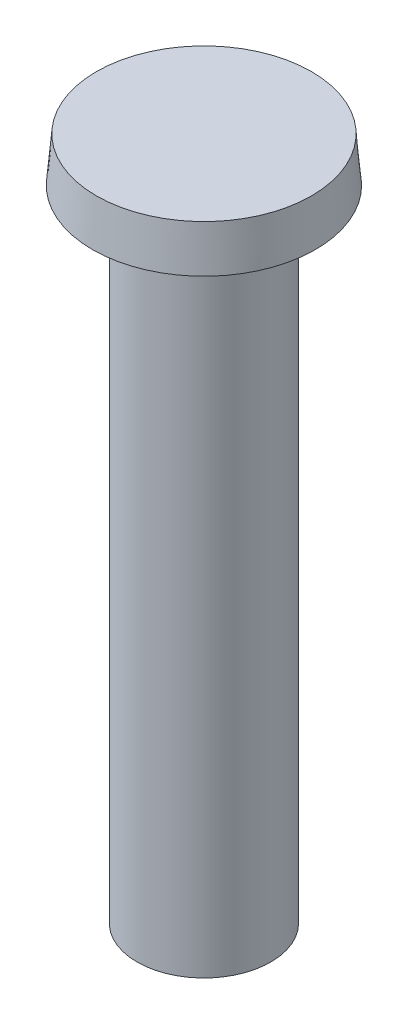
from build123d import *

# Parameters (mm, degrees)
SKETCH1_R           = 2.25
BOSS_EXTRUDE1_DEPTH = 21.5
SKETCH2_R           = 3.75
BOSS_EXTRUDE2_DEPTH = 1.5
BOSS_EXTRUDE2_TAPER = 5
SKETCH3_R           = 1
CUT_EXTRUDE1_DEPTH  = 6
CUT_EXTRUDE1_DRAFT  = -1


with BuildPart() as part:
    # Sketch1 → Boss-Extrude1 (new body)
    with BuildSketch(Plane(origin=(0, 0, 0), x_dir=(1, 0, 0), z_dir=(0, 1, 0))):
        with Locations(Location((0, 0, 0), (0, 0, 270))):
            Circle(SKETCH1_R)
    extrude(amount=BOSS_EXTRUDE1_DEPTH)

    # Sketch2 → Boss-Extrude2 (add)
    with BuildSketch(Plane(origin=(0, 21.5, 0), x_dir=(1, 0, 0), z_dir=(0, 1, 0))):
        Circle(SKETCH2_R)
    extrude(amount=BOSS_EXTRUDE2_DEPTH, taper=BOSS_EXTRUDE2_TAPER)


with BuildPart() as cut_extrude1_tool:
    # Sketch3 → Cut-Extrude1 (with draft: the straight prism first)
    with BuildSketch(Plane.XZ):
        Circle(SKETCH3_R)
    extrude(amount=-CUT_EXTRUDE1_DEPTH)
    # Cut-Extrude1: the draft: its side faces are tilted about the plane it starts from
    cut_extrude1_sides = [cut_extrude1_tool.faces().sort_by_distance(p)[0] for p in [
        (-1, 3, 0),
    ]]
    draft(cut_extrude1_sides, Plane.XZ, CUT_EXTRUDE1_DRAFT)


with BuildPart() as part_1:
    add(part.part)

    # Cut-Extrude1: cut by cut_extrude1_tool
    add(cut_extrude1_tool.part, mode=Mode.SUBTRACT)


solid = part_1.part
